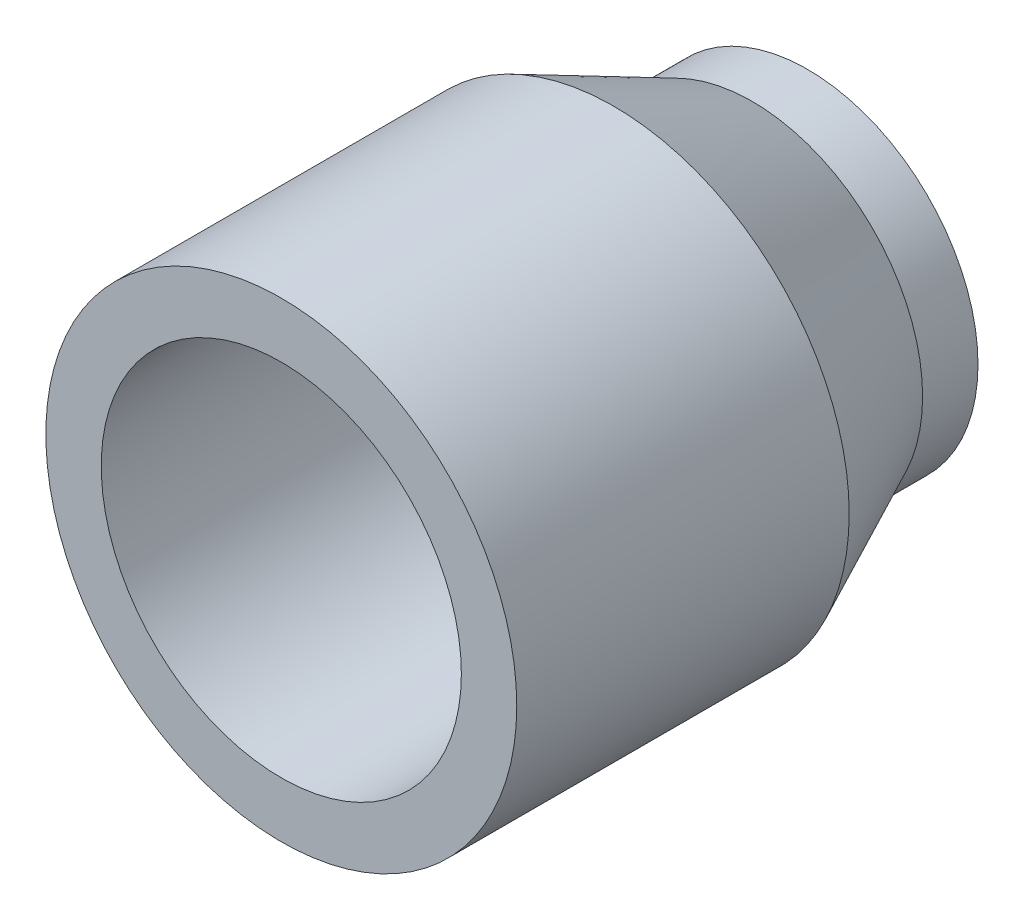
from build123d import *

# Parameters (mm, degrees)
SKETCH1_R           = 6.15
SKETCH2_R           = 8.5
SKETCH1_3_R         = 4.15
SKETCH2_3_R         = 6.5
SKETCH1_4_R         = 6.15
SKETCH1_4_R_2       = 4.15
BOSS_EXTRUDE1_DEPTH = 2
SKETCH2_4_R         = 8.5
SKETCH2_4_R_2       = 6.5
BOSS_EXTRUDE2_DEPTH = 12


with BuildPart() as part:
    # Sketch1 → Loft1 section 0
    with BuildSketch(Plane.XY):
        Circle(SKETCH1_R)
    # Sketch2 → Loft1 section 1
    with BuildSketch(Plane.XY.offset(5)):
        Circle(SKETCH2_R)
    loft()

    # Sketch1<3> → Cut-Loft1 section 0
    with BuildSketch(Plane.XY):
        Circle(SKETCH1_3_R)
    # Sketch2<3> → Cut-Loft1 section 1
    with BuildSketch(Plane.XY.offset(5)):
        Circle(SKETCH2_3_R)
    loft(mode=Mode.SUBTRACT)

    # Sketch1<4> → Boss-Extrude1 (add)
    with BuildSketch(Plane.XY):
        Circle(SKETCH1_4_R)
        Circle(SKETCH1_4_R_2, mode=Mode.SUBTRACT)
    extrude(amount=-BOSS_EXTRUDE1_DEPTH)

    # Sketch2<4> → Boss-Extrude2 (add)
    with BuildSketch(Plane.XY.offset(5)):
        Circle(SKETCH2_4_R)
        Circle(SKETCH2_4_R_2, mode=Mode.SUBTRACT)
    extrude(amount=BOSS_EXTRUDE2_DEPTH)


solid = part.part
